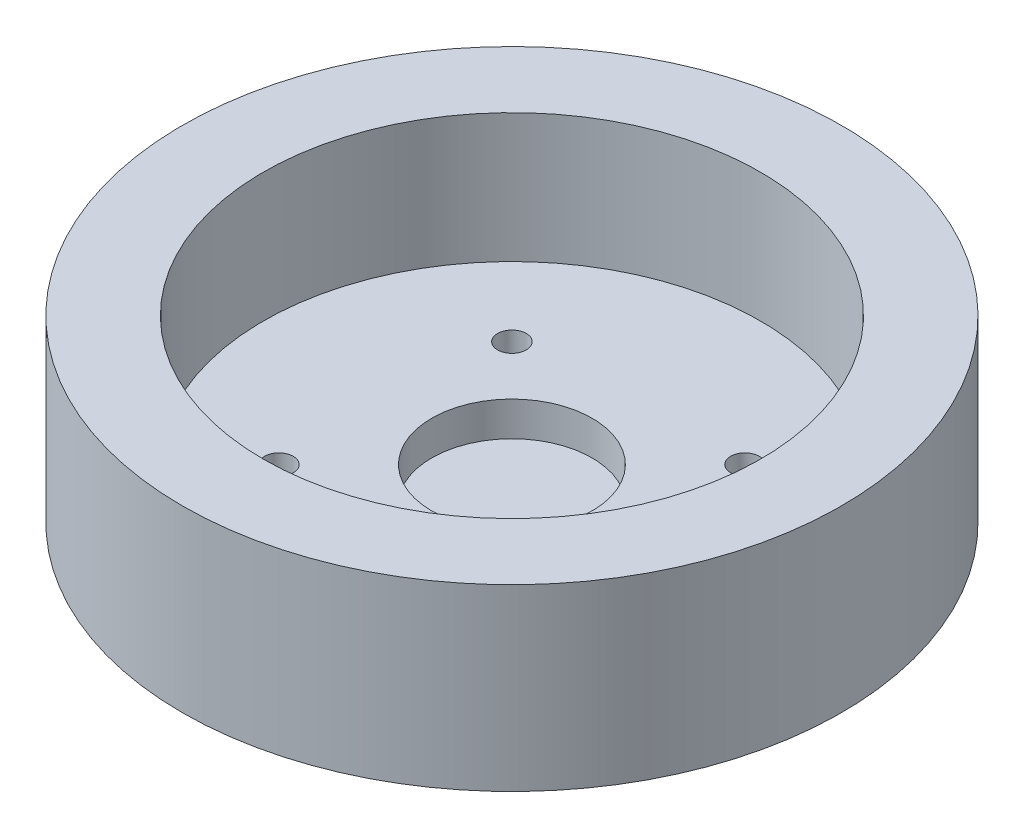
from build123d import *

# Parameters (mm, degrees)
SKETCH_1_R          = 17.35
SKETCH_1_R_2        = 5.6
EXTRUDE_1_DEPTH     = 3.5
SKETCH_3_R          = 23
SKETCH_3_R_2        = 17.35
EXTRUDE_3_DEPTH     = 12.5
SKETCH_4_R          = 5.6
EXTRUDE_4_DEPTH     = 1.1
SKETCH_6_R          = 1
CUT_EXTRUDE_3_DEPTH = 5
SKETCH_8_R          = 1.91
CUT_EXTRUDE_4_DEPTH = 1.9


with BuildPart() as part:
    # 草图1 → 凸台-拉伸1 (new body)
    with BuildSketch(Plane(origin=(0, 0, 0), x_dir=(1, 0, 0), z_dir=(0, 1, 0))):
        with Locations(Location((0, 0, 0), (0, 0, 270))):
            Circle(SKETCH_1_R)
        with Locations(Location((0, 0, 0), (0, 0, 270))):
            Circle(SKETCH_1_R_2, mode=Mode.SUBTRACT)
    extrude(amount=EXTRUDE_1_DEPTH)

    # 草图3 → 凸台-拉伸3 (add)
    with BuildSketch(Plane(origin=(0, 0, 0), x_dir=(1, 0, 0), z_dir=(0, 1, 0))):
        with Locations(Location((0, 0, 0), (0, 0, 270))):
            Circle(SKETCH_3_R)
        with Locations(Location((0, 0, 0), (0, 0, 270))):
            Circle(SKETCH_3_R_2, mode=Mode.SUBTRACT)
    extrude(amount=EXTRUDE_3_DEPTH)

    # 草图4 → 凸台-拉伸4 (add)
    with BuildSketch(Plane(origin=(0, 0, 0), x_dir=(1, 0, 0), z_dir=(0, 1, 0))):
        with Locations(Location((0, 0, 0), (0, 0, 270))):
            Circle(SKETCH_4_R)
    extrude(amount=EXTRUDE_4_DEPTH)

    # 草图6 → 切除-拉伸3 (cut, symmetric)
    with BuildSketch(Plane(origin=(0, 0, 0), x_dir=(1, 0, 0), z_dir=(0, 1, 0))):
        with Locations(Location((8.131727984, 8.131727984, 0), (0, 0, 270))):
            Circle(SKETCH_6_R)
        with Locations(Location((7.424621202, -7.424621202, 0), (0, 0, 270))):
            Circle(SKETCH_6_R)
        with Locations(Location((-8.131727984, -8.131727984, 0), (0, 0, 270))):
            Circle(SKETCH_6_R)
        with Locations(Location((-7.424621202, 7.424621202, 0), (0, 0, 270))):
            Circle(SKETCH_6_R)
    extrude(amount=CUT_EXTRUDE_3_DEPTH, both=True, mode=Mode.SUBTRACT)

    # 草图8 → 切除-拉伸4 (cut)
    with BuildSketch(Plane.XZ):
        with Locations(Location((-8.131727984, 8.131727984, 0), (0, 0, 270))):
            Circle(SKETCH_8_R)
        with Locations(Location((7.424621202, 7.424621202, 0), (0, 0, 270))):
            Circle(SKETCH_8_R)
        with Locations(Location((-7.424621202, -7.424621202, 0), (0, 0, 270))):
            Circle(SKETCH_8_R)
        with Locations(Location((8.131727984, -8.131727984, 0), (0, 0, 270))):
            Circle(SKETCH_8_R)
    extrude(amount=-CUT_EXTRUDE_4_DEPTH, mode=Mode.SUBTRACT)


solid = part.part
